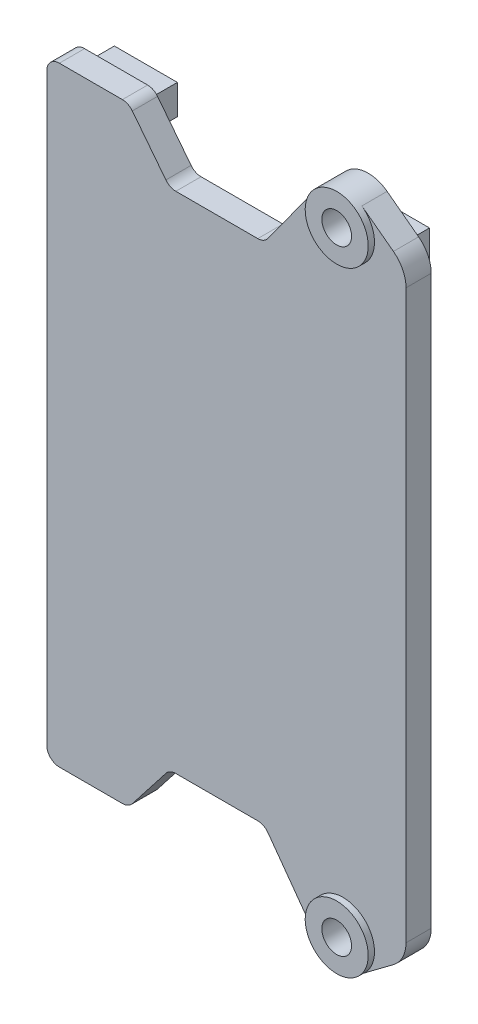
from build123d import *

# Parameters (mm, degrees)
SKETCH2_R           = 1.5
BOSS_EXTRUDE1_DEPTH = 2.54
SKETCH3_R           = 3.175
SKETCH3_R_2         = 1.5
BOSS_EXTRUDE2_DEPTH = 0.635
SKETCH4_W           = 6.35
SKETCH4_H           = 3
BOSS_EXTRUDE3_DEPTH = 3


with BuildPart() as part:
    # Sketch2 → Boss-Extrude1 (new body)
    with BuildSketch(Plane.XY):
        with BuildLine():
            Line((186.055, 33.49625), (189.23, 31.115))
            ThreePointArc((189.23, 31.115), (190.164806331, 29.994903166), (190.5, 28.575))
            Line((190.5, 28.575), (190.5, 0))
            Line((190.5, 0), (154.305, 0))
            Line((154.305, 0), (154.305, 29.44))
            ThreePointArc((154.305, 29.44), (154.676974388, 30.338025612), (155.575, 30.71))
            Line((155.575, 30.71), (161.925, 30.71))
            ThreePointArc((161.925, 30.71), (162.482139282, 30.58126939), (162.926332297, 30.221174521))
            Line((162.926332297, 30.221174521), (166.306150062, 25.888825479))
            ThreePointArc((166.306150062, 25.888825479), (166.750343077, 25.52873061), (167.307482358, 25.4))
            Line((167.307482358, 25.4), (175.563715168, 25.4))
            ThreePointArc((175.563715168, 25.4), (176.141475824, 25.539030228), (176.592738534, 25.925680906))
            Line((176.592738534, 25.925680906), (181.577441586, 32.817047734))
            ThreePointArc((181.577441586, 32.817047734), (183.673830399, 34.095340236), (186.055, 33.49625))
        make_face()
        with Locations((184.15, 30.95625)):
            Circle(SKETCH2_R, mode=Mode.SUBTRACT)
    extrude(amount=BOSS_EXTRUDE1_DEPTH)

    # Sketch3 → Boss-Extrude2 (add)
    with BuildSketch(Plane.XY.offset(2.54)):
        with Locations(Location((184.15, 30.95625, 0), (0, 0, 144.120815799))):
            Circle(SKETCH3_R)
        with Locations((184.15, 30.95625)):
            Circle(SKETCH3_R_2, mode=Mode.SUBTRACT)
    extrude(amount=BOSS_EXTRUDE2_DEPTH)

    # Sketch4 → Boss-Extrude3 (add)
    with BuildSketch(Plane(origin=(0, 0, 0), x_dir=(-1, 0, 0), z_dir=(0, 0, -1))):
        with Locations((-184.15, 27.94)):
            Rectangle(SKETCH4_W, SKETCH4_H)
        with Locations((-158.75, 27.94)):
            Rectangle(SKETCH4_W, SKETCH4_H)
    extrude(amount=BOSS_EXTRUDE3_DEPTH)

    # Mirror1: part across plane


with BuildPart() as part_1:
    add(part.part)
    add(part.part.mirror(Plane.ZX))


solid = part_1.part
